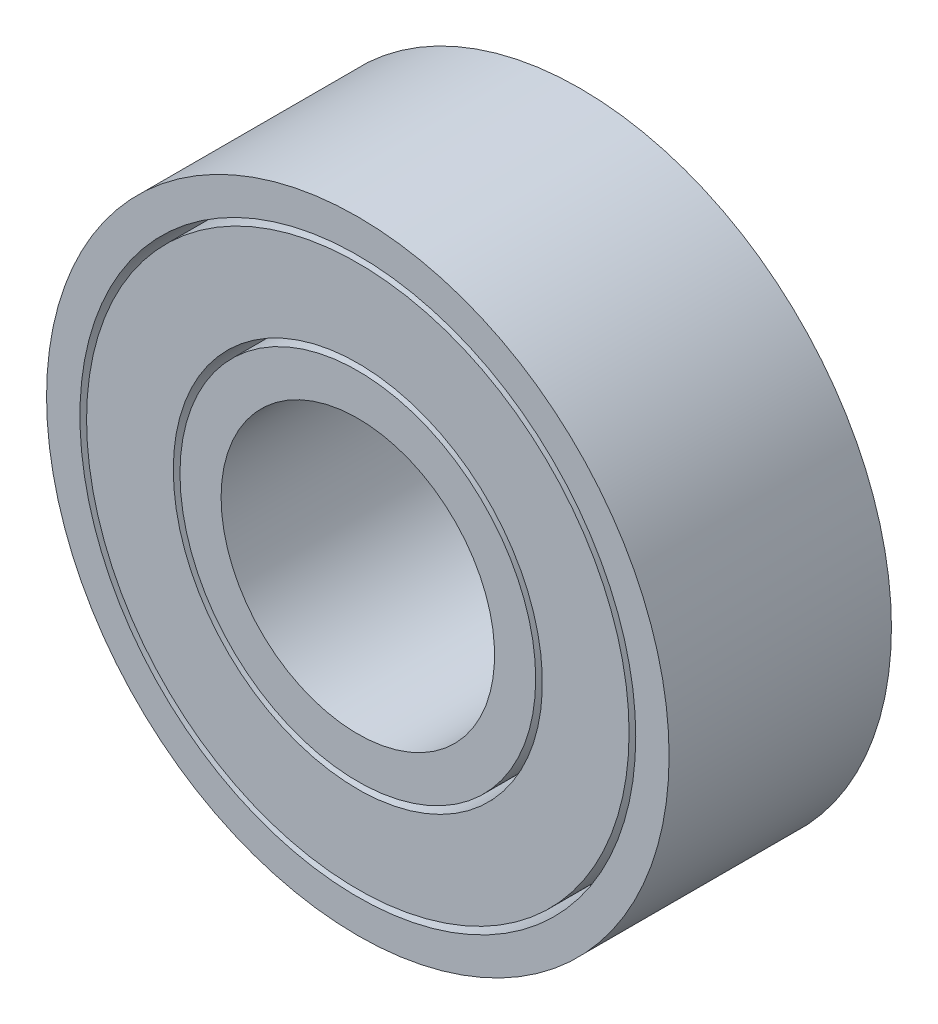
from build123d import *

# Parameters (mm, degrees)
SKETCH1_R           = 14
SKETCH1_R_2         = 12.5
BOSS_EXTRUDE1_DEPTH = 10
SKETCH2_R           = 12.2
SKETCH2_R_2         = 8.3
BOSS_EXTRUDE2_DEPTH = 10
SKETCH3_R           = 8
SKETCH3_R_2         = 6.15
BOSS_EXTRUDE3_DEPTH = 10


with BuildPart() as part:
    # Sketch1 → Boss-Extrude1 (new body)
    with BuildSketch(Plane.XY):
        Circle(SKETCH1_R)
        Circle(SKETCH1_R_2, mode=Mode.SUBTRACT)
    extrude(amount=BOSS_EXTRUDE1_DEPTH)


with BuildPart() as body_2:
    # Sketch2 → Boss-Extrude2 (new body)
    with BuildSketch(Plane(origin=(0, 0, 0), x_dir=(-1, 0, 0), z_dir=(0, 0, -1))):
        Circle(SKETCH2_R)
        Circle(SKETCH2_R_2, mode=Mode.SUBTRACT)
    extrude(amount=-BOSS_EXTRUDE2_DEPTH)


with BuildPart() as body_3:
    # Sketch3 → Boss-Extrude3 (new body)
    with BuildSketch(Plane(origin=(0, 0, 0), x_dir=(-1, 0, 0), z_dir=(0, 0, -1))):
        Circle(SKETCH3_R)
        Circle(SKETCH3_R_2, mode=Mode.SUBTRACT)
    extrude(amount=-BOSS_EXTRUDE3_DEPTH)


solid = Compound([part.part, body_2.part, body_3.part])
